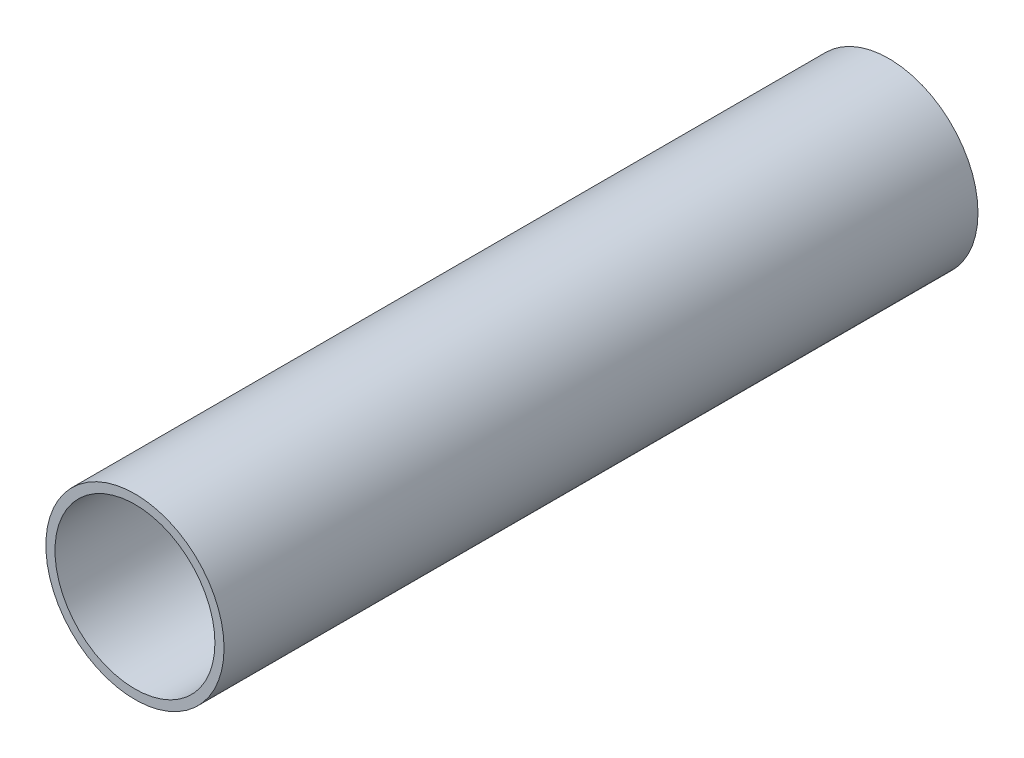
from build123d import *

# Parameters (mm, degrees)
SKETCH1_R           = 1.95
SKETCH1_R_2         = 1.75
BOSS_EXTRUDE1_DEPTH = 16.5


with BuildPart() as part:
    # Sketch1 → Boss-Extrude1 (new body)
    with BuildSketch(Plane.XY):
        Circle(SKETCH1_R)
        Circle(SKETCH1_R_2, mode=Mode.SUBTRACT)
    extrude(amount=BOSS_EXTRUDE1_DEPTH)


solid = part.part
